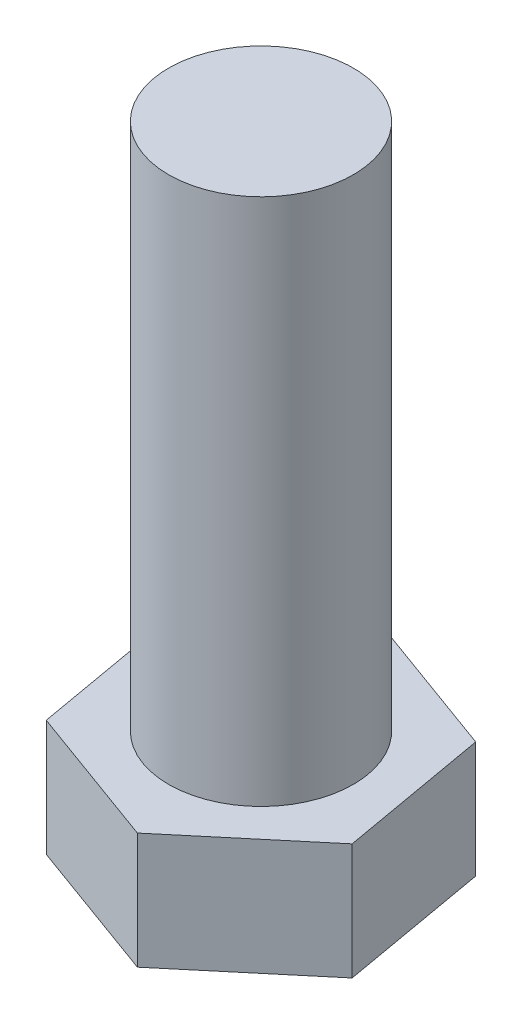
from build123d import *

# Parameters (mm, degrees)
EXTRUDE_1_DEPTH = 8.8
SKETCH_3_R      = 7
EXTRUDE_2_DEPTH = 40


with BuildPart() as part:
    # Эскиз1 → Вытянуть1 (new body)
    with BuildSketch(Plane(origin=(0, 0, 0), x_dir=(1, 0, 0), z_dir=(0, 1, 0))):
        Polygon((2.006700186, -11.371301056), (10.851185681, -3.947797189), (8.844485495, 7.423503867), (-2.006700186, 11.371301056), (-10.851185681, 3.947797189), (-8.844485495, -7.423503867), align=None)
    extrude(amount=EXTRUDE_1_DEPTH)

    # Эскиз3 → Вытянуть2 (add)
    with BuildSketch(Plane(origin=(0, 8.8, 0), x_dir=(1, 0, 0), z_dir=(0, 1, 0))):
        with Locations(Location((0, 0, 0), (0, 0, 270))):
            Circle(SKETCH_3_R)
    extrude(amount=EXTRUDE_2_DEPTH)


solid = part.part
